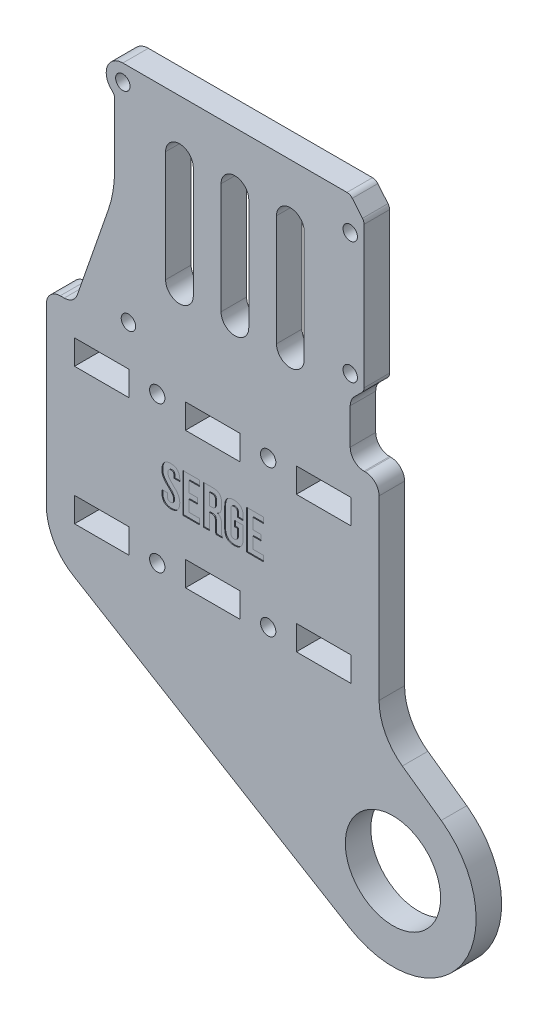
from build123d import *

# Parameters (mm, degrees)
SKETCH1_W           = 12.5
SKETCH1_H           = 5.642
SKETCH1_R           = 1.7526
SKETCH1_R_2         = 10.9125
SKETCH1_R_3         = 2.413
BOSS_EXTRUDE1_DEPTH = 5.842
FILLET1_R           = 3.175
FILLET2_R           = 3.175
FILLET3_R           = 3.175
SKETCH5_W           = 89.898374518
SKETCH5_H           = 85.880879638
CUT_EXTRUDE3_DEPTH  = 119.085758265
SKETCH6_R           = 1.651
BOSS_EXTRUDE3_DEPTH = 5.842
FILLET6_R           = 3.175
FILLET7_R           = 1.5875
CUT_EXTRUDE4_DEPTH  = 100.162930498
CUT_EXTRUDE6_DEPTH  = 0.1984375
FILLET8_R           = 25.4
FILLET10_R          = 12.7
FILLET11_R          = 12.7


with BuildPart() as part:
    # Sketch1 → Boss-Extrude1 (new body)
    with BuildSketch(Plane.XY):
        with BuildLine():
            Line((38.1, -25.146), (38.1, -12.8))
            Line((38.1, -12.8), (38.1, 12.8))
            Line((38.1, 12.8), (38.1, 25.146))
            Line((38.1, 25.146), (31.65, 25.146))
            Line((31.65, 25.146), (31.65, 101.346))
            Line((31.65, 101.346), (-6.45, 101.346))
            Line((-6.45, 101.346), (-31.65, 25.146))
            Line((-31.65, 25.146), (-38.1, 25.146))
            Line((-38.1, 25.146), (-38.1, 12.8))
            Line((-38.1, 12.8), (-38.1, -12.8))
            Line((-38.1, -12.8), (-38.1, -25.146))
            Line((-38.1, -25.146), (31.431657464, -67.109846956))
            ThreePointArc((31.431657464, -67.109846956), (57.198562634, -61.256703737), (52.329925224, -35.285776581))
            Line((52.329925224, -35.285776581), (38.1, -25.146))
        make_face()
        with Locations((-25.4, -15.621)):
            Rectangle(SKETCH1_W, SKETCH1_H, mode=Mode.SUBTRACT)
        with Locations((-25.4, 15.621)):
            Rectangle(SKETCH1_W, SKETCH1_H, mode=Mode.SUBTRACT)
        with Locations((-12.7, -16.76875)):
            Circle(SKETCH1_R, mode=Mode.SUBTRACT)
        with Locations((0, -15.621)):
            Rectangle(SKETCH1_W, SKETCH1_H, mode=Mode.SUBTRACT)
        with Locations((0, 15.621)):
            Rectangle(SKETCH1_W, SKETCH1_H, mode=Mode.SUBTRACT)
        with Locations((41.275, -50.8)):
            Circle(SKETCH1_R_2, mode=Mode.SUBTRACT)
        with Locations((12.7, -16.76875)):
            Circle(SKETCH1_R, mode=Mode.SUBTRACT)
        with Locations((25.4, -15.621)):
            Rectangle(SKETCH1_W, SKETCH1_H, mode=Mode.SUBTRACT)
        with Locations((25.4, 15.621)):
            Rectangle(SKETCH1_W, SKETCH1_H, mode=Mode.SUBTRACT)
        Polygon((-24.961764059, 25.146), (-6.45, 81.122048465), (-6.45, 25.146), align=None, mode=Mode.SUBTRACT)
        with Locations((-12.7, 16.76875)):
            Circle(SKETCH1_R, mode=Mode.SUBTRACT)
        with Locations((12.7, 16.76875)):
            Circle(SKETCH1_R, mode=Mode.SUBTRACT)
        with Locations((12.6, 94.996)):
            Circle(SKETCH1_R_3, mode=Mode.SUBTRACT)
    extrude(amount=BOSS_EXTRUDE1_DEPTH)

    # Fillet1
    fillet1_edges = [part.edges().sort_by_distance(p)[0] for p in [
        (-38.1, 25.146, 2.921),
        (-31.65, 25.146, 2.921),
        (31.65, 25.146, 2.921),
        (38.1, 25.146, 2.921),
    ]]
    fillet(fillet1_edges, radius=FILLET1_R)

    # Fillet2
    fillet2_edges = [part.edges().sort_by_distance(p)[0] for p in [
        (-24.961764059, 25.146, 2.921),
        (-6.45, 25.146, 2.921),
        (-6.45, 81.122048465, 2.921),
    ]]
    fillet(fillet2_edges, radius=FILLET2_R)

    # Fillet3
    fillet3_edges = [part.edges().sort_by_distance(p)[0] for p in [
        (-6.45, 101.346, 2.921),
        (31.65, 101.346, 2.921),
    ]]
    fillet(fillet3_edges, radius=FILLET3_R)

    # Sketch5 → Cut-Extrude3 (cut, through all)
    with BuildSketch(Plane.XY.offset(5.842)):
        with Locations((-10.124187259, 68.086439819)):
            Rectangle(SKETCH5_W, SKETCH5_H)
    extrude(amount=-CUT_EXTRUDE3_DEPTH, mode=Mode.SUBTRACT)

    # Sketch6 → Boss-Extrude3 (add)
    with BuildSketch(Plane.XY.offset(5.842)):
        with BuildLine():
            Line((31.48787854, 25.146), (-22.48712146, 25.146))
            Line((-22.48712146, 25.146), (-25.027909725, 25.146))
            Line((-25.027909725, 25.146), (-31.75, 25.146))
            Line((-31.75, 25.146), (-22.48712146, 51.816))
            Line((-22.48712146, 51.816), (-22.48712146, 71.376443212))
            ThreePointArc((-22.48712146, 71.376443212), (-24.262298858, 75.662100562), (-20.58212146, 78.486))
            Line((-20.58212146, 78.486), (31.48787854, 78.486))
            Line((31.48787854, 78.486), (34.66287854, 74.676))
            Line((34.66287854, 74.676), (34.66287854, 41.021))
            Line((34.66287854, 41.021), (31.48787854, 37.846))
            Line((31.48787854, 37.846), (31.48787854, 25.146))
        make_face()
        with Locations((31.48787854, 70.866)):
            Circle(SKETCH6_R, mode=Mode.SUBTRACT)
        with Locations((31.48787854, 42.926)):
            Circle(SKETCH6_R, mode=Mode.SUBTRACT)
        with Locations((-20.58212146, 74.676)):
            Circle(SKETCH6_R, mode=Mode.SUBTRACT)
        with Locations((-19.31212146, 27.686)):
            Circle(SKETCH6_R, mode=Mode.SUBTRACT)
    extrude(amount=-BOSS_EXTRUDE3_DEPTH)

    # Fillet6
    fillet6_edges = [part.edges().sort_by_distance(p)[0] for p in [
        (31.48787854, 37.846, 2.921),
        (-31.75, 25.146, 2.921),
        (31.48787854, 25.146, 2.921),
    ]]
    fillet(fillet6_edges, radius=FILLET6_R)

    # Fillet7
    fillet7_edges = [part.edges().sort_by_distance(p)[0] for p in [
        (34.66287854, 41.021, 2.921),
        (34.66287854, 74.676, 2.921),
        (31.48787854, 78.486, 2.921),
        (-22.48712146, 71.376443212, 2.921),
    ]]
    fillet(fillet7_edges, radius=FILLET7_R)

    # Sketch7 → Cut-Extrude4 (cut, through all)
    with BuildSketch(Plane.XY.offset(5.842)):
        with BuildLine():
            Line((8.256105927, 65.786), (8.256105927, 40.386))
            ThreePointArc((8.256105927, 40.386), (5.081105927, 37.211), (1.906105927, 40.386))
            Line((1.906105927, 40.386), (1.906105927, 65.786))
            ThreePointArc((1.906105927, 65.786), (5.081105927, 68.961), (8.256105927, 65.786))
        make_face()
        with BuildLine():
            Line((20.956105927, 65.786), (20.956105927, 40.386))
            ThreePointArc((20.956105927, 40.386), (17.781105927, 37.211), (14.606105927, 40.386))
            Line((14.606105927, 40.386), (14.606105927, 65.786))
            ThreePointArc((14.606105927, 65.786), (17.781105927, 68.961), (20.956105927, 65.786))
        make_face()
        with BuildLine():
            Line((-10.793894073, 65.786), (-10.793894073, 40.386))
            ThreePointArc((-10.793894073, 40.386), (-7.618894073, 37.211), (-4.443894073, 40.386))
            Line((-4.443894073, 40.386), (-4.443894073, 65.786))
            ThreePointArc((-4.443894073, 65.786), (-7.618894073, 68.961), (-10.793894073, 65.786))
        make_face()
    extrude(amount=-CUT_EXTRUDE4_DEPTH, mode=Mode.SUBTRACT)

    # Sketch10 → Cut-Extrude6 (cut)
    # profile 1 of 5: a face of its own
    with BuildSketch(Plane.XY.offset(5.842)):
        with BuildLine():
            add(Edge.make_bspline(
                [(-11.638881579, 2.335293997), (-11.638010326, 2.421901413), (-11.636318858, 2.590042872), (-11.608009506, 2.833882722), (-11.57273459, 3.063310635), (-11.51412931, 3.276011473), (-11.445009169, 3.475182626), (-11.353137848, 3.655881088), (-11.252216141, 3.824969032), (-11.130031623, 3.974500843), (-10.9940529, 4.110382218), (-10.840114632, 4.22620463), (-10.671704923, 4.32721628), (-10.486301334, 4.406527761), (-10.284912922, 4.469605283), (-10.067790035, 4.511446429), (-9.835095353, 4.540491478), (-9.674796233, 4.543462506), (-9.591842105, 4.545)],
                knots=[0, 0, 0, 0, 1.206355524, 2.342043972, 3.418431402, 4.438083895, 5.413196573, 6.351255772, 7.258638977, 8.152530083, 9.035258528, 9.932049271, 10.830647535, 11.766204879, 12.735829353, 13.766735853, 14.844295107, 16, 16, 16, 16], degree=3))
            add(Edge.make_bspline(
                [(-9.591842105, 4.545), (-9.508888902, 4.543432814), (-9.34798627, 4.540392975), (-9.115277217, 4.511657811), (-8.897835233, 4.469920428), (-8.697746497, 4.404188038), (-8.511113422, 4.325300957), (-8.342766317, 4.223321735), (-8.188926399, 4.106131387), (-8.05347064, 3.969031532), (-7.931854396, 3.81698942), (-7.82796067, 3.647776822), (-7.739329437, 3.463555936), (-7.669168608, 3.263325639), (-7.611760122, 3.04841856), (-7.572412593, 2.817181406), (-7.548308694, 2.570370001), (-7.545991913, 2.400540544), (-7.544802632, 2.313361431)],
                knots=[0, 0, 0, 0, 1.149502785, 2.229667057, 3.246762745, 4.213732507, 5.144269167, 6.049624213, 6.934898484, 7.818842031, 8.714531651, 9.628669906, 10.56558659, 11.543414927, 12.565757919, 13.64612032, 14.791675208, 16, 16, 16, 16], degree=3))
            Line((-7.544802632, 2.313361431), (-7.544802632, 1.971578947))
            Line((-7.544802632, 1.971578947), (-8.831513158, 1.971578947))
            Line((-8.831513158, 1.971578947), (-8.831513158, 2.395608553))
            add(Edge.make_bspline(
                [(-8.831513158, 2.395608553), (-8.833219257, 2.468841125), (-8.836398646, 2.605313116), (-8.869023042, 2.793073834), (-8.927643312, 2.946276372), (-9.009075511, 3.067597566), (-9.116914286, 3.152083609), (-9.237790638, 3.217709416), (-9.380622508, 3.250605115), (-9.480832167, 3.255646908), (-9.533355263, 3.258289474)],
                knots=[0, 0, 0, 0, 1.37650492, 2.565175047, 3.562948912, 4.443316981, 5.273581903, 6.113981485, 7.011477219, 8, 8, 8, 8], degree=3))
            add(Edge.make_bspline(
                [(-9.533355263, 3.258289474), (-9.585972307, 3.255933108), (-9.686512764, 3.251430573), (-9.827990621, 3.214792954), (-9.950988253, 3.152779331), (-10.056953987, 3.065461209), (-10.139211273, 2.944647561), (-10.197638596, 2.79117862), (-10.230327403, 2.603506834), (-10.23349669, 2.467020895), (-10.235197368, 2.393780839)],
                knots=[0, 0, 0, 0, 0.987915514, 1.887705382, 2.722343528, 3.559412626, 4.43923987, 5.436400785, 6.624340691, 8, 8, 8, 8], degree=3))
            add(Edge.make_bspline(
                [(-10.235197368, 2.393780839), (-10.232761349, 2.320504563), (-10.228019666, 2.177873133), (-10.190347742, 1.970194931), (-10.129294129, 1.775174518), (-10.007910505, 1.534204616), (-9.812199822, 1.253843116), (-9.535004883, 0.937297517), (-9.220594419, 0.634164958), (-8.886470936, 0.3310884), (-8.551625172, 0.013953675), (-8.292359609, -0.276924927), (-8.098925913, -0.525759947), (-7.96796649, -0.727415334), (-7.848129451, -0.940720337), (-7.741624558, -1.167159855), (-7.652168812, -1.41033452), (-7.587933799, -1.673703363), (-7.552244543, -1.958235933), (-7.547333343, -2.154691002), (-7.544802632, -2.255923109)],
                knots=[0, 0, 0, 0, 0.711271441, 1.384481704, 2.043180969, 2.688888555, 3.996911697, 5.351796161, 6.770259715, 8.235863846, 9.733980013, 11.246991605, 12.015089241, 12.793015811, 13.579825842, 14.389856151, 15.22096519, 16.092101288, 17.016871351, 18, 18, 18, 18], degree=3))
            add(Edge.make_bspline(
                [(-7.544802632, -2.255923109), (-7.545755413, -2.342515417), (-7.547605163, -2.510627545), (-7.574744905, -2.754179681), (-7.613795617, -2.982400918), (-7.670614438, -3.195289666), (-7.742963824, -3.393512977), (-7.83378644, -3.575264345), (-7.937157868, -3.743770953), (-8.060929807, -3.893437597), (-8.198032244, -4.028076248), (-8.351838383, -4.144262785), (-8.520443466, -4.243143752), (-8.705042626, -4.324087066), (-8.905031574, -4.385908457), (-9.120660102, -4.428904497), (-9.351054285, -4.45722148), (-9.510116048, -4.460360733), (-9.591842105, -4.461973684)],
                knots=[0, 0, 0, 0, 1.208931604, 2.347045229, 3.418793377, 4.440623261, 5.420741355, 6.360803708, 7.274613492, 8.175773814, 9.066465746, 9.953246112, 10.861092314, 11.790851666, 12.7625467, 13.778975678, 14.858835979, 16, 16, 16, 16], degree=3))
            add(Edge.make_bspline(
                [(-9.591842105, -4.461973684), (-9.673568294, -4.460360922), (-9.832630311, -4.457222036), (-10.063022696, -4.428902462), (-10.278657505, -4.385915468), (-10.478624576, -4.324062572), (-10.663300676, -4.243230062), (-10.832049559, -4.143704135), (-10.987208743, -4.028608498), (-11.124816153, -3.894053799), (-11.245938791, -3.742520165), (-11.352557687, -3.576433373), (-11.440088068, -3.392877023), (-11.513276629, -3.195399235), (-11.569829266, -2.982369494), (-11.608956527, -2.754188803), (-11.636074314, -2.510625038), (-11.637927188, -2.342514565), (-11.638881579, -2.255923109)],
                knots=[0, 0, 0, 0, 1.141004639, 2.220714119, 3.237001136, 4.208560456, 5.138189951, 6.045909358, 6.939358402, 7.829925934, 8.725600764, 9.643828138, 10.580015742, 11.559996947, 12.581684114, 13.653282575, 14.791237243, 16, 16, 16, 16], degree=3))
            Line((-11.638881579, -2.255923109), (-11.638881579, -1.654605263))
            Line((-11.638881579, -1.654605263), (-10.35582648, -1.654605263))
            Line((-10.35582648, -1.654605263), (-10.35582648, -2.334514803))
            add(Edge.make_bspline(
                [(-10.35582648, -2.334514803), (-10.353427303, -2.40715112), (-10.348999254, -2.54121261), (-10.316266897, -2.726054645), (-10.256803333, -2.876813879), (-10.170473004, -2.99354823), (-10.061124625, -3.075159992), (-9.939036444, -3.13449869), (-9.800344098, -3.170174456), (-9.702939012, -3.173519311), (-9.652156661, -3.175263158)],
                knots=[0, 0, 0, 0, 1.386265988, 2.558566959, 3.564945677, 4.453418966, 5.290801522, 6.143785094, 7.032258383, 8, 8, 8, 8], degree=3))
            add(Edge.make_bspline(
                [(-9.652156661, -3.175263158), (-9.600685381, -3.173805532), (-9.502362818, -3.171021116), (-9.363916439, -3.131937702), (-9.240803303, -3.074285905), (-9.134471087, -2.98896435), (-9.046323215, -2.872623779), (-8.988653693, -2.718972344), (-8.95506151, -2.531546937), (-8.950802007, -2.395607742), (-8.948486842, -2.321720806)],
                knots=[0, 0, 0, 0, 0.970990002, 1.85482519, 2.70053532, 3.52885375, 4.409750974, 5.428903785, 6.602533864, 8, 8, 8, 8], degree=3))
            add(Edge.make_bspline(
                [(-8.948486842, -2.321720806), (-8.951047547, -2.248478222), (-8.956052905, -2.105312459), (-8.992147771, -1.896967435), (-9.057220097, -1.703052075), (-9.146601658, -1.522781738), (-9.254898932, -1.352769197), (-9.373179128, -1.186245741), (-9.504976364, -1.024917213), (-9.701690136, -0.817173894), (-9.961857256, -0.557227942), (-10.297616531, -0.255775232), (-10.632015622, 0.062394519), (-10.892597613, 0.352464068), (-11.087531154, 0.601098269), (-11.214513228, 0.805835791), (-11.337976914, 1.017569959), (-11.443963488, 1.245311003), (-11.533577287, 1.488920628), (-11.595153467, 1.753362286), (-11.631608894, 2.037566646), (-11.636408415, 2.234048228), (-11.638881579, 2.335293997)],
                knots=[0, 0, 0, 0, 0.789355349, 1.542936557, 2.269747914, 2.986341759, 3.706087991, 4.440454517, 5.187108408, 5.949139981, 7.52326873, 9.149767973, 10.812348446, 12.495832652, 13.348252618, 14.213526384, 15.089941792, 15.988897831, 16.917420784, 17.882650749, 18.908942757, 20, 20, 20, 20], degree=3))
        make_face()
    # profile 2 of 5: a face of its own
    with BuildSketch(Plane.XY.offset(5.842)):
        Polygon((-5.439276316, 0.801842105), (-3.531143092, 0.801842105), (-3.531143092, -0.484868421), (-5.439276316, -0.484868421), (-5.439276316, -3.058289474), (-3.039488076, -3.058289474), (-3.039488076, -4.345), (-6.842960526, -4.345), (-6.842960526, 4.545), (-3.039488076, 4.545), (-3.039488076, 3.258289474), (-5.439276316, 3.258289474), align=None)
    # profile 3 of 5: a face of its own
    with BuildSketch(Plane.XY.offset(5.842)):
        with BuildLine():
            add(Edge.make_bspline(
                [(0.77129523, -4.345), (0.76303458, -4.316282306), (0.747156589, -4.261083349), (0.718545887, -4.178732813), (0.693985571, -4.088636196), (0.670765451, -3.981007858), (0.658648673, -3.847423806), (0.646114673, -3.682990836), (0.645234656, -3.480469408), (0.644021476, -3.33182626), (0.643355263, -3.250199424)],
                knots=[0, 0, 0, 0, 0.646416717, 1.242492799, 1.88527074, 2.665971912, 3.620858849, 4.783497717, 6.233669654, 8, 8, 8, 8], degree=3))
            Line((0.643355263, -3.250199424), (0.643355263, -1.851998355))
            add(Edge.make_bspline(
                [(0.643355263, -1.851998355), (0.642469861, -1.802036591), (0.640762312, -1.705682495), (0.632913801, -1.566326583), (0.614092055, -1.438884882), (0.590281776, -1.322971071), (0.562351865, -1.217516594), (0.523556283, -1.124883778), (0.479832842, -1.04266238), (0.411382831, -0.949930312), (0.303304383, -0.852278609), (0.138170185, -0.774470821), (-0.058271777, -0.726760701), (-0.200128164, -0.721583994), (-0.275984786, -0.718815789)],
                knots=[0, 0, 0, 0, 1.063180337, 2.050403593, 2.966938367, 3.800733177, 4.568108724, 5.283005847, 5.93264735, 6.544464347, 7.72853363, 8.986425435, 10.388513958, 12, 12, 12, 12], degree=3))
            Line((-0.275984786, -0.718815789), (-0.760328947, -0.718815789))
            Line((-0.760328947, -0.718815789), (-0.760328947, -4.345))
            Line((-0.760328947, -4.345), (-2.164013158, -4.345))
            Line((-2.164013158, -4.345), (-2.164013158, 4.545))
            Line((-2.164013158, 4.545), (-0.03838199, 4.545))
            add(Edge.make_bspline(
                [(-0.03838199, 4.545), (0.050011048, 4.543821023), (0.221050301, 4.541539721), (0.468558938, 4.517707037), (0.697036567, 4.477710983), (0.906842353, 4.423989633), (1.097341277, 4.35199493), (1.269238985, 4.264755537), (1.423208549, 4.162250088), (1.556507717, 4.041354227), (1.67184605, 3.904662907), (1.773950215, 3.753143255), (1.859139352, 3.584759619), (1.929112168, 3.400396895), (1.981340623, 3.1998338), (2.019169668, 2.983454376), (2.043702223, 2.750746254), (2.045903697, 2.590020301), (2.047039474, 2.507099095)],
                knots=[0, 0, 0, 0, 1.260755043, 2.439542802, 3.54268581, 4.567257681, 5.524513305, 6.441873985, 7.312115338, 8.155196257, 8.999888502, 9.858066866, 10.755993349, 11.685786731, 12.666123341, 13.707841755, 14.817437245, 16, 16, 16, 16], degree=3))
            Line((2.047039474, 2.507099095), (2.047039474, 1.810740132))
            add(Edge.make_bspline(
                [(2.047039474, 1.810740132), (2.04447227, 1.701531904), (2.039544486, 1.491905126), (1.995642657, 1.191891491), (1.922881472, 0.921140769), (1.823025462, 0.677910071), (1.690659354, 0.464746451), (1.526325667, 0.283908049), (1.336384361, 0.127255311), (1.189666865, 0.052294512), (1.114905428, 0.014097451)],
                knots=[0, 0, 0, 0, 1.219454911, 2.340761394, 3.377591561, 4.344542733, 5.267952596, 6.16435728, 7.064629016, 8, 8, 8, 8], degree=3))
            add(Edge.make_bspline(
                [(1.114905428, 0.014097451), (1.157948004, -0.004592408), (1.242817123, -0.041444101), (1.361061365, -0.109589242), (1.470188602, -0.184348605), (1.567583767, -0.269021816), (1.65430673, -0.362625546), (1.728705213, -0.465989847), (1.795881791, -0.575845485), (1.868400268, -0.737628647), (1.94251196, -0.957656242), (2.003504609, -1.244046841), (2.039897322, -1.556188815), (2.044601557, -1.7726952), (2.047039474, -1.884897204)],
                knots=[0, 0, 0, 0, 0.746038726, 1.471000451, 2.167407001, 2.847638854, 3.519882004, 4.192614133, 4.870840316, 5.564746539, 7.008468503, 8.556058101, 10.215215764, 12, 12, 12, 12], degree=3))
            Line((2.047039474, -1.884897204), (2.047039474, -3.261165707))
            add(Edge.make_bspline(
                [(2.047039474, -3.261165707), (2.048758922, -3.364760027), (2.051978301, -3.558722968), (2.067446383, -3.83705793), (2.109580674, -4.098506649), (2.168600233, -4.261674936), (2.19873972, -4.345)],
                knots=[0, 0, 0, 0, 1.128713682, 2.113326532, 3.036533446, 4, 4, 4, 4], degree=3))
            Line((2.19873972, -4.345), (0.77129523, -4.345))
        make_face()
        with BuildLine():
            Line((-0.760328947, 3.258289474), (-0.760328947, 0.567894737))
            Line((-0.760328947, 0.567894737), (-0.206531661, 0.567894737))
            add(Edge.make_bspline(
                [(-0.206531661, 0.567894737), (-0.143586792, 0.570225495), (-0.023834204, 0.574659762), (0.145888633, 0.61134959), (0.294505293, 0.673035025), (0.422707296, 0.763061611), (0.526314442, 0.889821063), (0.595435674, 1.057663705), (0.636441504, 1.263507292), (0.640923777, 1.413292219), (0.643355263, 1.494545641)],
                knots=[0, 0, 0, 0, 1.040413653, 1.979386563, 2.855406841, 3.686020353, 4.545419899, 5.524684786, 6.657222482, 8, 8, 8, 8], degree=3))
            Line((0.643355263, 1.494545641), (0.643355263, 2.357226562))
            add(Edge.make_bspline(
                [(0.643355263, 2.357226562), (0.641665597, 2.431114992), (0.638517613, 2.568775044), (0.605502112, 2.758726727), (0.555165212, 2.918623158), (0.476277359, 3.045993881), (0.373125906, 3.143888799), (0.24458601, 3.212397093), (0.090718836, 3.252647701), (-0.019844779, 3.256331907), (-0.078591694, 3.258289474)],
                knots=[0, 0, 0, 0, 1.332324762, 2.48222755, 3.469917333, 4.339549643, 5.15640083, 6.007761516, 6.941443205, 8, 8, 8, 8], degree=3))
            Line((-0.078591694, 3.258289474), (-0.760328947, 3.258289474))
        make_face(mode=Mode.SUBTRACT)
    # profile 4 of 5: a face of its own
    with BuildSketch(Plane.XY.offset(5.842)):
        with BuildLine():
            Line((4.971381579, 0.577033306), (6.959934211, 0.577033306))
            Line((6.959934211, 0.577033306), (6.959934211, -2.228507401))
            add(Edge.make_bspline(
                [(6.959934211, -2.228507401), (6.957940557, -2.315673969), (6.9540711, -2.484854462), (6.931036341, -2.731308436), (6.889037686, -2.961742354), (6.830687466, -3.177168493), (6.755512534, -3.377302781), (6.664857932, -3.563393775), (6.55409498, -3.731589855), (6.42947692, -3.885139378), (6.287438502, -4.021022928), (6.130477968, -4.140607453), (5.955826558, -4.239387157), (5.767181925, -4.322859362), (5.560390282, -4.383614934), (5.339187139, -4.429366396), (5.101848725, -4.457131107), (4.938558167, -4.460326809), (4.854407895, -4.461973684)],
                knots=[0, 0, 0, 0, 1.194042732, 2.317502508, 3.386327591, 4.398534127, 5.370341948, 6.310795775, 7.227362706, 8.122753804, 9.013935309, 9.913516301, 10.818153436, 11.756123454, 12.732863071, 13.763916448, 14.847655113, 16, 16, 16, 16], degree=3))
            add(Edge.make_bspline(
                [(4.854407895, -4.461973684), (4.770243157, -4.460393841), (4.606924529, -4.457328212), (4.369904054, -4.428661737), (4.14812323, -4.386163811), (3.942116378, -4.324085008), (3.752160668, -4.243078534), (3.577399577, -4.144542311), (3.41962336, -4.026582749), (3.277056667, -3.8923313), (3.153201714, -3.739665042), (3.044735176, -3.572393547), (2.952747537, -3.389827868), (2.877886601, -3.191247259), (2.820041146, -2.976925833), (2.777727702, -2.747779617), (2.754754683, -2.503132296), (2.750878893, -2.335168963), (2.748881579, -2.248612253)],
                knots=[0, 0, 0, 0, 1.15723574, 2.245574074, 3.279340441, 4.260225597, 5.198852961, 6.114605703, 7.012976626, 7.9021542, 8.801345571, 9.71020866, 10.63966306, 11.607756255, 12.62425886, 13.689377335, 14.809264553, 16, 16, 16, 16], degree=3))
            Line((2.748881579, -2.248612253), (2.748881579, 2.331638569))
            add(Edge.make_bspline(
                [(2.748881579, 2.331638569), (2.750900743, 2.418193996), (2.754833075, 2.586761139), (2.777624794, 2.832027913), (2.819770327, 3.061243822), (2.878160509, 3.274820756), (2.953173397, 3.473248183), (3.044300887, 3.656829683), (3.152659579, 3.824377991), (3.277694274, 3.975433853), (3.41954374, 4.109675821), (3.577421445, 4.227550292), (3.752154606, 4.326109932), (3.942118099, 4.407109882), (4.148122733, 4.469190543), (4.369904197, 4.511687933), (4.60692449, 4.54035456), (4.770243144, 4.543420168), (4.854407895, 4.545)],
                knots=[0, 0, 0, 0, 1.190640111, 2.318777811, 3.383811006, 4.392151913, 5.360167597, 6.297034964, 7.205825284, 8.098478489, 8.987584871, 9.885883865, 10.801563287, 11.7401155, 12.72092212, 13.754605719, 14.842856915, 16, 16, 16, 16], degree=3))
            add(Edge.make_bspline(
                [(4.854407895, 4.545), (4.938537136, 4.543138117), (5.101718834, 4.539526708), (5.339277314, 4.514716298), (5.560531172, 4.468674345), (5.76618067, 4.406654186), (5.956868581, 4.328964178), (6.129163824, 4.228425637), (6.288042058, 4.113594258), (6.429361284, 3.97905894), (6.553605405, 3.827771889), (6.664350915, 3.663355968), (6.755937746, 3.481955942), (6.830994475, 3.285296944), (6.888513521, 3.073318997), (6.931297022, 2.846698324), (6.954023405, 2.604431517), (6.957923806, 2.437688583), (6.959934211, 2.351743421)],
                knots=[0, 0, 0, 0, 1.163067864, 2.255950316, 3.296598009, 4.282426534, 5.222507501, 6.135562604, 7.033458149, 7.927116913, 8.824340661, 9.735373492, 10.66200178, 11.627104322, 12.640608114, 13.694531985, 14.811680848, 16, 16, 16, 16], degree=3))
            Line((6.959934211, 2.351743421), (6.959934211, 1.503684211))
            Line((6.959934211, 1.503684211), (5.673223684, 1.503684211))
            Line((5.673223684, 1.503684211), (5.673223684, 2.417541118))
            add(Edge.make_bspline(
                [(5.673223684, 2.417541118), (5.671054635, 2.488984256), (5.667012749, 2.622114038), (5.630856513, 2.805798437), (5.564589266, 2.955626565), (5.47167963, 3.071754018), (5.357079251, 3.157544676), (5.223546937, 3.215611124), (5.07401256, 3.253733157), (4.96797821, 3.256731746), (4.912894737, 3.258289474)],
                knots=[0, 0, 0, 0, 1.318101835, 2.456199662, 3.432506804, 4.312407925, 5.171583763, 6.047379065, 6.985638684, 8, 8, 8, 8], degree=3))
            add(Edge.make_bspline(
                [(4.912894737, 3.258289474), (4.857930853, 3.255624674), (4.752309783, 3.250503875), (4.600891251, 3.217292715), (4.469802652, 3.152826686), (4.352702182, 3.068268919), (4.261420715, 2.94773623), (4.19460007, 2.794259485), (4.158903249, 2.605560654), (4.154776771, 2.468855621), (4.152565789, 2.395608553)],
                knots=[0, 0, 0, 0, 1.001091666, 1.923742725, 2.796739089, 3.643998758, 4.529096847, 5.512089028, 6.666967977, 8, 8, 8, 8], degree=3))
            Line((4.152565789, 2.395608553), (4.152565789, -2.325376234))
            add(Edge.make_bspline(
                [(4.152565789, -2.325376234), (4.154685287, -2.398658923), (4.158623756, -2.534833428), (4.195164891, -2.722527688), (4.260258344, -2.875431273), (4.353680321, -2.992369268), (4.468887795, -3.076493384), (4.60266084, -3.132175856), (4.751726923, -3.170839556), (4.857794173, -3.173750803), (4.912894737, -3.175263158)],
                knots=[0, 0, 0, 0, 1.340899589, 2.491670802, 3.480464611, 4.353283275, 5.198873926, 6.063096006, 6.993803431, 8, 8, 8, 8], degree=3))
            add(Edge.make_bspline(
                [(4.912894737, -3.175263158), (4.967968335, -3.173692634), (5.073983675, -3.170669415), (5.223649536, -3.132717745), (5.35639024, -3.074206829), (5.472802142, -2.99060971), (5.565437171, -2.871480989), (5.630327287, -2.717572976), (5.667459767, -2.528155063), (5.671197123, -2.390746647), (5.673223684, -2.316237664)],
                knots=[0, 0, 0, 0, 1.000478149, 1.925896174, 2.789704808, 3.630489795, 4.507022972, 5.500343297, 6.644574443, 8, 8, 8, 8], degree=3))
            Line((5.673223684, -2.316237664), (5.673223684, -0.687744655))
            Line((5.673223684, -0.687744655), (4.971381579, -0.687744655))
            Line((4.971381579, -0.687744655), (4.971381579, 0.577033306))
        make_face()
    # profile 5 of 5: a face of its own
    with BuildSketch(Plane.XY.offset(5.842)):
        Polygon((9.182434211, 0.801842105), (11.090567434, 0.801842105), (11.090567434, -0.484868421), (9.182434211, -0.484868421), (9.182434211, -3.058289474), (11.582222451, -3.058289474), (11.582222451, -4.345), (7.77875, -4.345), (7.77875, 4.545), (11.582222451, 4.545), (11.582222451, 3.258289474), (9.182434211, 3.258289474), align=None)
    extrude(amount=-CUT_EXTRUDE6_DEPTH, mode=Mode.SUBTRACT)

    # Fillet8
    fillet8_edges = [part.edges().sort_by_distance(p)[0] for p in [
        (-22.48712146, 51.816, 2.921),
    ]]
    fillet(fillet8_edges, radius=FILLET8_R)

    # Fillet10
    fillet10_edges = [part.edges().sort_by_distance(p)[0] for p in [
        (-38.1, -25.146, 2.921),
    ]]
    fillet(fillet10_edges, radius=FILLET10_R)

    # Fillet11
    fillet11_edges = [part.edges().sort_by_distance(p)[0] for p in [
        (38.1, -25.146, 2.921),
    ]]
    fillet(fillet11_edges, radius=FILLET11_R)


solid = part.part
